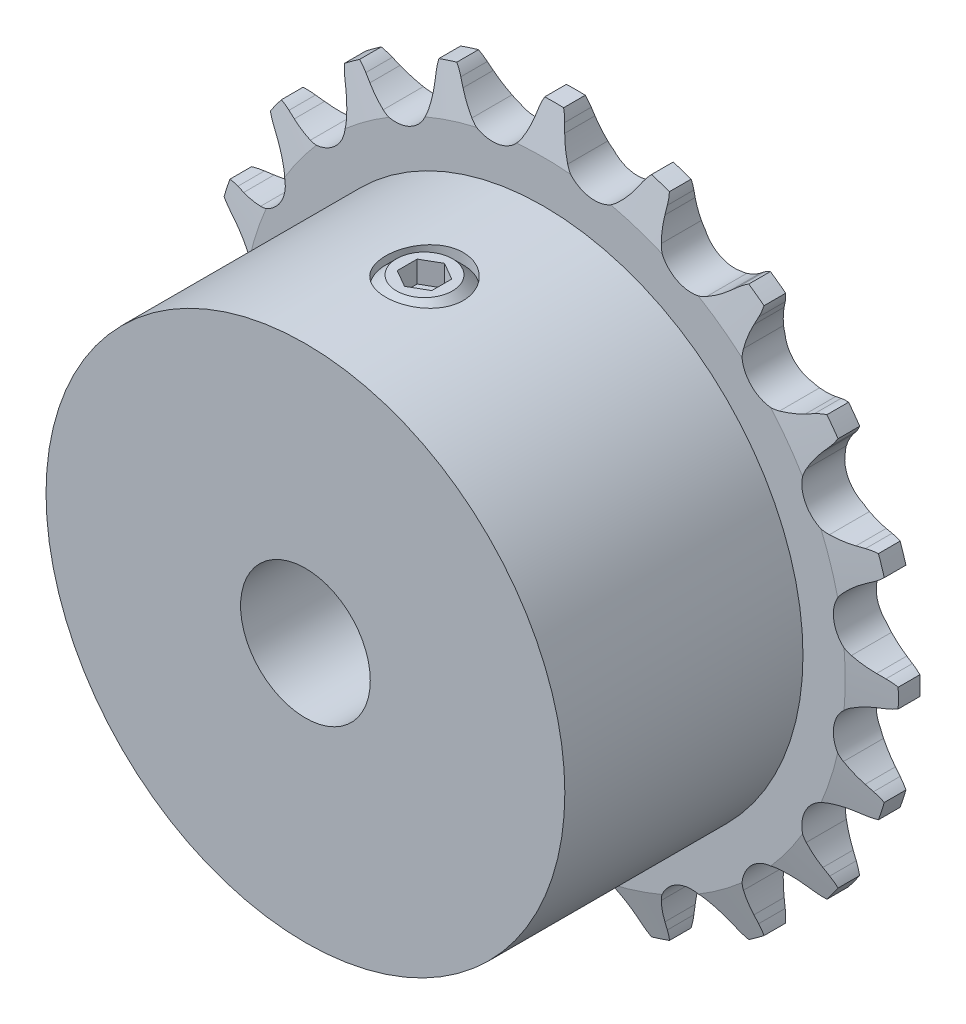
from build123d import *

# Parameters (mm, degrees)
CUT_EXTRUDE1_DEPTH      = 19.332658996
CIRPATTERN1_COUNT       = 20
BOSS_EXTRUDE1_START     = 0.7874
SKETCH2_R               = 9.525
BOSS_EXTRUDE1_DEPTH     = 8.74395
CUT_EXTRUDE2_DEPTH      = 21.647349106
CUT_EXTRUDE2_DEPTH_BACK = 21.647349106
SKETCH3_OUTSIDE_W       = 35.514
SKETCH3_OUTSIDE_H       = 35.514
SKETCH3_OUTSIDE_R       = 12.6365
SKETCH3_OUTSIDE_R_2     = 2.38125
CUT_EXTRUDE3_REACH      = 29.233
CUT_EXTRUDE3_END_RADIUS = 2.38125
SKETCH5_R               = 1.4224
CUT_EXTRUDE4_DEPTH      = 0.79375


with BuildPart() as part:
    # Sketch1 → Revolve1 (revolve)
    with BuildSketch(Plane(origin=(0, 0, 0), x_dir=(0, 0, -1), z_dir=(1, 0, 0))):
        Polygon((0.7874, 0), (-0.7874, 0), (-0.7874, 11.077935025), (-0.3190875, 12.951185025), (0.3190875, 12.951185025), (0.7874, 11.077935025), align=None)
    revolve(axis=Axis((0, 0, -0.7874), (0, 0, 1)))

    # Sketch0 → Cut-Extrude1 (cut, symmetric)
    with BuildSketch(Plane.XY):
        with BuildLine():
            Line((3.338569051, -11.816932679), (3.188960552, -11.575638873))
            ThreePointArc((3.188960552, -11.575638873), (2.956278354, -11.250631818), (2.682655884, -10.959253481))
            ThreePointArc((2.682655884, -10.959253481), (1.68759123, -10.655031687), (0.835238212, -11.251855695))
            ThreePointArc((0.835238212, -11.251855695), (0.665048636, -11.613526954), (0.544187419, -11.994529786))
            Line((0.544187419, -11.994529786), (0.476465168, -12.270245401))
            ThreePointArc((0.476465168, -12.270245401), (-0.264578826, -13.35046461), (-1.534251986, -13.672877091))
            ThreePointArc((-1.534251986, -13.672877091), (2.152333006, -13.589295778), (5.684311732, -12.529568916))
            ThreePointArc((5.684311732, -12.529568916), (4.377149864, -12.615287009), (3.338569051, -11.816932679))
        make_face()
    cut_extrude1 = extrude(amount=CUT_EXTRUDE1_DEPTH, both=True, mode=Mode.SUBTRACT)

    # CirPattern1: Cut-Extrude1 ×20 about axis
    cirpattern1_axis = Axis((0, 0, 0), (0, 0, 1))
    for i in range(1, CIRPATTERN1_COUNT):
        add(cut_extrude1.rotate(cirpattern1_axis, i * 360 / CIRPATTERN1_COUNT), mode=Mode.SUBTRACT)

    # Sketch2 → Boss-Extrude1 (add)
    with BuildSketch(Plane.XY.offset(BOSS_EXTRUDE1_START)):
        with Locations(Location((0, 0, 0), (0, 0, 270))):
            Circle(SKETCH2_R)
    extrude(amount=BOSS_EXTRUDE1_DEPTH)

    # Sketch3 outside → Cut-Extrude2 (cut, two sides: drawn at the far end of the back side and taken through both)
    # profile 1 of 2: a face of its own
    with BuildSketch(Plane.XY.offset(-CUT_EXTRUDE2_DEPTH_BACK)):
        Rectangle(SKETCH3_OUTSIDE_W, SKETCH3_OUTSIDE_H)
        Circle(SKETCH3_OUTSIDE_R, mode=Mode.SUBTRACT)
    # profile 2 of 2: a face of its own
    with BuildSketch(Plane.XY.offset(-CUT_EXTRUDE2_DEPTH_BACK)):
        Circle(SKETCH3_OUTSIDE_R_2)
    extrude(amount=CUT_EXTRUDE2_DEPTH + CUT_EXTRUDE2_DEPTH_BACK, mode=Mode.SUBTRACT)

    # Cut-Extrude3: up to this cylinder (the profile starts outside it)
    cut_extrude3_end = Plane(origin=(0, 0, 5.159375), z_dir=(0, 0, -1)) * Cylinder(CUT_EXTRUDE3_END_RADIUS, 64.2285, mode=Mode.PRIVATE)
    # Sketch5 → Cut-Extrude3 (cut, up to the surface)
    with BuildSketch(Plane(origin=(0, 9.525, 0), x_dir=(-1, 0, 0), z_dir=(0, 1, 0)), mode=Mode.PRIVATE) as cut_extrude3_sk1:
        with Locations(Location((0, 5.159375, 0), (0, 0, 90))):
            Circle(SKETCH5_R)
    cut_extrude3_tool1 = extrude(cut_extrude3_sk1.sketch, amount=-CUT_EXTRUDE3_REACH, mode=Mode.PRIVATE) - cut_extrude3_end
    add(cut_extrude3_tool1.solids().sort_by_distance((0, 9.525, 5.159375))[0], mode=Mode.SUBTRACT)


with BuildPart() as body_2:
    # Sketch6 → Revolve2 (revolve)
    with BuildSketch(Plane(origin=(0, 0, 0), x_dir=(0, 0, -1), z_dir=(1, 0, 0))):
        Polygon((-5.159375, 9.525), (-5.159375, 2.38125), (-6.1849, 2.38125), (-6.581775, 2.778125), (-6.581775, 9.128125), (-6.1849, 9.525), align=None)
    revolve(axis=Axis((0, 2.38125, 5.159375), (0, -1, 0)))

    # Sketch7 → Cut-Extrude4 (cut)
    with BuildSketch(Plane(origin=(0, 9.525, 0), x_dir=(1, 0, 0), z_dir=(0, 1, 0))):
        Polygon((0, -4.426140158), (-0.635, -4.792757579), (-0.635, -5.525992421), (0, -5.892609842), (0.635, -5.525992421), (0.635, -4.792757579), align=None)
    extrude(amount=-CUT_EXTRUDE4_DEPTH, mode=Mode.SUBTRACT)


solid = Compound([part.part, body_2.part])
